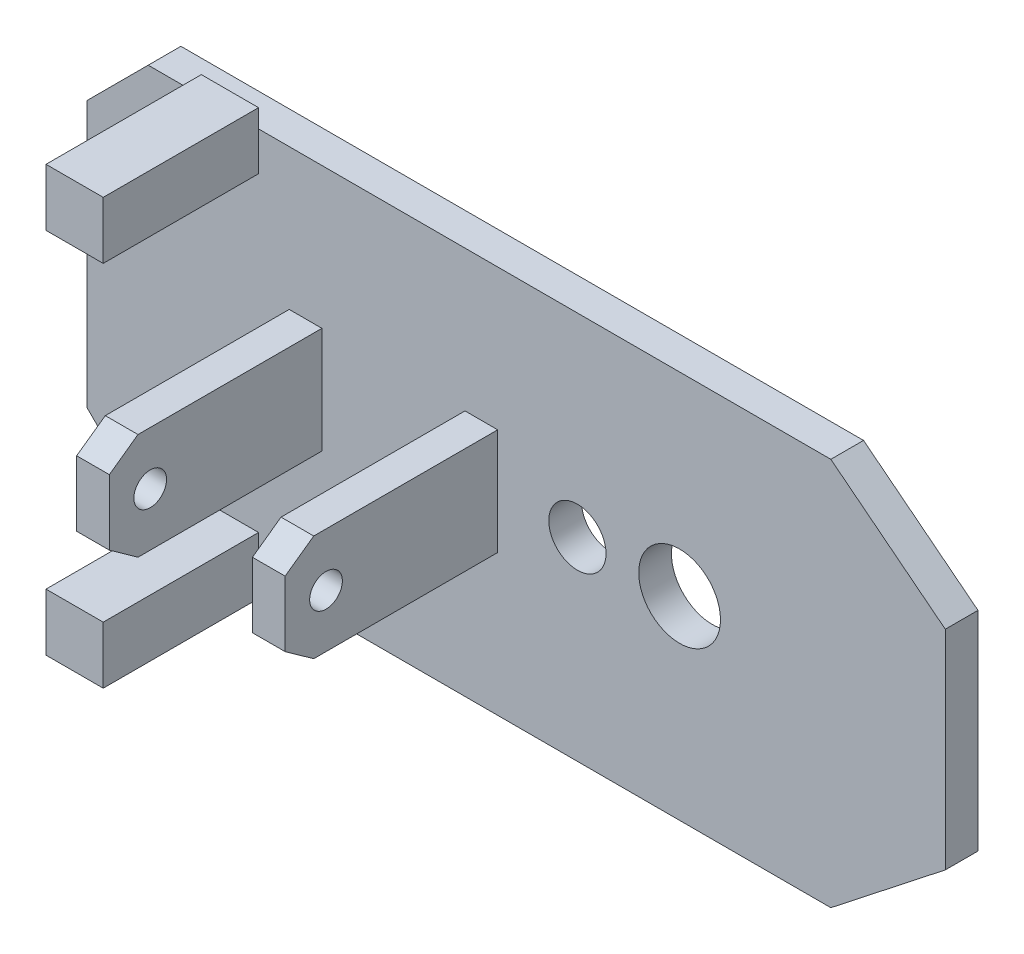
from build123d import *

# Parameters (mm, degrees)
SK_SOLE_PLATE_R    = 10
SK_SOLE_PLATE_R_2  = 7
SOLE_PLATE_DEPTH   = 8
SK_CLEVIS_FRONT_R  = 4
CLEVIS_FRONT_DEPTH = 8
SK_CLEVIS_BACK_R   = 4
CLEVIS_BACK_DEPTH  = 8
SK_POST_LAT_W      = 14
SK_POST_LAT_H      = 14
POST_LAT_DEPTH     = 38
SK_POST_MED_W      = 14
SK_POST_MED_H      = 14
POST_MED_DEPTH     = 38


with BuildPart() as part:
    # SK_Sole_Plate → Sole_Plate (new body)
    with BuildSketch(Plane.XY.offset(-50)):
        Polygon((-60, -47.5), (107, -47.5), (135, -25.5), (135, 25.5), (107, 47.5), (-60, 47.5), (-75, 32.5), (-75, -32.5), align=None)
        with Locations((70, 0)):
            Circle(SK_SOLE_PLATE_R, mode=Mode.SUBTRACT)
        with Locations((45, 0)):
            Circle(SK_SOLE_PLATE_R_2, mode=Mode.SUBTRACT)
    extrude(amount=SOLE_PLATE_DEPTH)

    # SK_Clevis_Front → Clevis_Front (add)
    with BuildSketch(Plane(origin=(17.5, 0, 0), x_dir=(0, 0, -1), z_dir=(1, 0, 0))):
        Polygon((42, -13), (42, 13), (-3, 13), (-10, 8), (-10, -8), (-3, -13), align=None)
        Circle(SK_CLEVIS_FRONT_R, mode=Mode.SUBTRACT)
    extrude(amount=CLEVIS_FRONT_DEPTH)

    # SK_Clevis_Back → Clevis_Back (add)
    with BuildSketch(Plane(origin=(-25.5, 0, 0), x_dir=(0, 0, -1), z_dir=(1, 0, 0))):
        Polygon((42, -13), (42, 13), (-3, 13), (-10, 8), (-10, -8), (-3, -13), align=None)
        Circle(SK_CLEVIS_BACK_R, mode=Mode.SUBTRACT)
    extrude(amount=CLEVIS_BACK_DEPTH)

    # SK_Post_Lat → Post_Lat (add)
    with BuildSketch(Plane.XY.offset(-42)):
        with Locations((-40, 45)):
            Rectangle(SK_POST_LAT_W, SK_POST_LAT_H)
    extrude(amount=POST_LAT_DEPTH)

    # SK_Post_Med → Post_Med (add)
    with BuildSketch(Plane.XY.offset(-42)):
        with Locations((-40, -45)):
            Rectangle(SK_POST_MED_W, SK_POST_MED_H)
    extrude(amount=POST_MED_DEPTH)


solid = part.part
